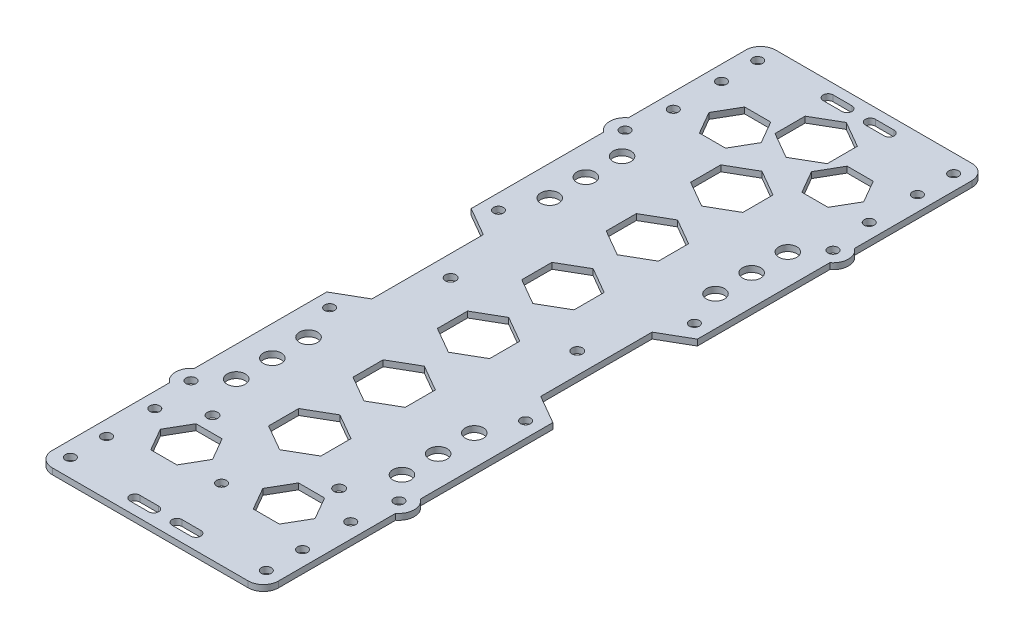
from build123d import *

# Parameters (mm, degrees)
SKETCH1_R           = 3
SKETCH1_R_2         = 1.65
BOSS_EXTRUDE1_DEPTH = 2
BOSS_EXTRUDE2_START = -2
SKETCH2_R           = 5.090936199
SKETCH2_R_2         = 1.65
BOSS_EXTRUDE2_DEPTH = 2
SKETCH3_R           = 1.65
CUT_EXTRUDE1_DEPTH  = 10
SKETCH4_R           = 1.75
CUT_EXTRUDE2_DEPTH  = 10


with BuildPart() as part:
    # Sketch1 → Boss-Extrude1 (new body)
    with BuildSketch(Plane(origin=(0, 0, 0), x_dir=(1, 0, 0), z_dir=(0, 1, 0))):
        with BuildLine():
            Line((37.525062814, 115), (37.525062814, 23.974506194))
            Line((37.525062814, 23.974506194), (28, 18.475208614))
            Line((28, 18.475208614), (28, -18.475208614))
            Line((28, -18.475208614), (37.525062814, -23.974506194))
            Line((37.525062814, -23.974506194), (37.525062814, -115))
            ThreePointArc((37.525062814, -115), (36.05174681, -118.544424535), (32.5, -120))
            Line((32.5, -120), (-32.5, -120))
            ThreePointArc((-32.5, -120), (-36.224769498, -118.363426816), (-37.5, -114.5))
            Line((-37.5, -114.5), (-37.5, -23.960036171))
            Line((-37.5, -23.960036171), (-28, -18.475208614))
            Line((-28, -18.475208614), (-28, 18.475208614))
            Line((-28, 18.475208614), (-37.5, 23.960036171))
            Line((-37.5, 23.960036171), (-37.5, 115.5))
            ThreePointArc((-37.5, 115.5), (-35.879164781, 118.708099244), (-32.525062814, 120))
            Line((-32.525062814, 120), (32.525062814, 120))
            ThreePointArc((32.525062814, 120), (36.06059672, 118.535533906), (37.525062814, 115))
        make_face()
        with Locations(Location((-27.497748671, 63.999999894, 0), (0, 0, 270))):
            Circle(SKETCH1_R, mode=Mode.SUBTRACT)
        with Locations(Location((-27.498874335, 51.999999947, 0), (0, 0, 270))):
            Circle(SKETCH1_R, mode=Mode.SUBTRACT)
        with Locations(Location((-27.5, 40, 0), (0, 0, 270))):
            Circle(SKETCH1_R, mode=Mode.SUBTRACT)
        with Locations(Location((27.5, 40, 0), (0, 0, 90))):
            Circle(SKETCH1_R, mode=Mode.SUBTRACT)
        with Locations(Location((27.498874335, 51.999999947, 0), (0, 0, 90))):
            Circle(SKETCH1_R, mode=Mode.SUBTRACT)
        with Locations(Location((27.497748671, 63.999999894, 0), (0, 0, 90))):
            Circle(SKETCH1_R, mode=Mode.SUBTRACT)
        with Locations(Location((27.497748671, -63.999999894, 0), (0, 0, 270))):
            Circle(SKETCH1_R, mode=Mode.SUBTRACT)
        with Locations(Location((27.498874335, -51.999999947, 0), (0, 0, 270))):
            Circle(SKETCH1_R, mode=Mode.SUBTRACT)
        with Locations(Location((27.5, -40, 0), (0, 0, 270))):
            Circle(SKETCH1_R, mode=Mode.SUBTRACT)
        with Locations(Location((-27.5, -40, 0), (0, 0, 90))):
            Circle(SKETCH1_R, mode=Mode.SUBTRACT)
        with Locations(Location((-27.498874335, -51.999999947, 0), (0, 0, 90))):
            Circle(SKETCH1_R, mode=Mode.SUBTRACT)
        with Locations(Location((-27.497748671, -63.999999894, 0), (0, 0, 90))):
            Circle(SKETCH1_R, mode=Mode.SUBTRACT)
        with Locations(Location((-34.497748671, 71.999999894, 0), (0, 0, 270))):
            Circle(SKETCH1_R_2, mode=Mode.SUBTRACT)
        with Locations(Location((34.497748671, 71.999999894, 0), (0, 0, 90))):
            Circle(SKETCH1_R_2, mode=Mode.SUBTRACT)
        with Locations(Location((34.497748671, -71.999999894, 0), (0, 0, 270))):
            Circle(SKETCH1_R_2, mode=Mode.SUBTRACT)
        with Locations(Location((-34.497748671, -71.999999894, 0), (0, 0, 90))):
            Circle(SKETCH1_R_2, mode=Mode.SUBTRACT)
    extrude(amount=BOSS_EXTRUDE1_DEPTH)

    # Sketch2 → Boss-Extrude2 (add)
    # profile 1 of 4: a face of its own
    with BuildSketch(Plane(origin=(0, 2, 0), x_dir=(1, 0, 0), z_dir=(0, 1, 0)).offset(BOSS_EXTRUDE2_START)):
        with Locations((-34.497748671, 71.999999894)):
            Circle(SKETCH2_R)
        with Locations(Location((-34.497748671, 71.999999894, 0), (0, 0, 270))):
            Circle(SKETCH2_R_2, mode=Mode.SUBTRACT)
    # profile 2 of 4: a face of its own
    with BuildSketch(Plane(origin=(0, 2, 0), x_dir=(1, 0, 0), z_dir=(0, 1, 0)).offset(BOSS_EXTRUDE2_START)):
        with Locations((34.497748671, 71.999999894)):
            Circle(SKETCH2_R)
        with Locations(Location((34.497748671, 71.999999894, 0), (0, 0, 90))):
            Circle(SKETCH2_R_2, mode=Mode.SUBTRACT)
    # profile 3 of 4: a face of its own
    with BuildSketch(Plane(origin=(0, 2, 0), x_dir=(1, 0, 0), z_dir=(0, 1, 0)).offset(BOSS_EXTRUDE2_START)):
        with Locations((34.497748671, -71.999999894)):
            Circle(SKETCH2_R)
        with Locations(Location((34.497748671, -71.999999894, 0), (0, 0, 270))):
            Circle(SKETCH2_R_2, mode=Mode.SUBTRACT)
    # profile 4 of 4: a face of its own
    with BuildSketch(Plane(origin=(0, 2, 0), x_dir=(1, 0, 0), z_dir=(0, 1, 0)).offset(BOSS_EXTRUDE2_START)):
        with Locations((-34.497748671, -71.999999894)):
            Circle(SKETCH2_R)
        with Locations(Location((-34.497748671, -71.999999894, 0), (0, 0, 90))):
            Circle(SKETCH2_R_2, mode=Mode.SUBTRACT)
    extrude(amount=BOSS_EXTRUDE2_DEPTH)

    # Sketch3 → Cut-Extrude1 (cut)
    with BuildSketch(Plane(origin=(0, 2, 0), x_dir=(1, 0, 0), z_dir=(0, 1, 0))):
        with Locations(Location((-32.5, 114, 0), (0, 0, 270))):
            Circle(SKETCH3_R)
        with Locations(Location((-32.5, 102, 0), (0, 0, 270))):
            Circle(SKETCH3_R)
        with Locations(Location((-32.5, 86, 0), (0, 0, 270))):
            Circle(SKETCH3_R)
        with Locations(Location((-32.5, 28, 0), (0, 0, 270))):
            Circle(SKETCH3_R)
        with Locations(Location((32.5, 28, 0), (0, 0, 90))):
            Circle(SKETCH3_R)
        with Locations(Location((32.5, 86, 0), (0, 0, 90))):
            Circle(SKETCH3_R)
        with Locations(Location((32.5, 102, 0), (0, 0, 90))):
            Circle(SKETCH3_R)
        with Locations(Location((32.5, 114, 0), (0, 0, 90))):
            Circle(SKETCH3_R)
        with Locations(Location((32.5, -114, 0), (0, 0, 270))):
            Circle(SKETCH3_R)
        with Locations(Location((32.5, -102, 0), (0, 0, 270))):
            Circle(SKETCH3_R)
        with Locations(Location((32.5, -86, 0), (0, 0, 270))):
            Circle(SKETCH3_R)
        with Locations(Location((32.5, -28, 0), (0, 0, 270))):
            Circle(SKETCH3_R)
        with Locations(Location((0, -96.35, 0), (0, 0, 270))):
            Circle(SKETCH3_R)
        with Locations(Location((-32.5, -28, 0), (0, 0, 90))):
            Circle(SKETCH3_R)
        with Locations(Location((-32.5, -86, 0), (0, 0, 90))):
            Circle(SKETCH3_R)
        with Locations(Location((-32.5, -102, 0), (0, 0, 90))):
            Circle(SKETCH3_R)
        with Locations(Location((-32.5, -114, 0), (0, 0, 90))):
            Circle(SKETCH3_R)
        Polygon((0, 82.909485966), (-8.660254038, 77.909485966), (-8.660254038, 67.909485966), (0, 62.909485966), (8.660254038, 67.909485966), (8.660254038, 77.909485966), align=None)
        Polygon((0, 110.909485966), (-8.660254038, 105.909485966), (-8.660254038, 95.909485966), (0, 90.909485966), (8.660254038, 95.909485966), (8.660254038, 105.909485966), align=None)
        Polygon((0, 54.909485966), (-8.660254038, 49.909485966), (-8.660254038, 39.909485966), (0, 34.909485966), (8.660254038, 39.909485966), (8.660254038, 49.909485966), align=None)
        Polygon((0, 26.909485966), (-8.660254038, 21.909485966), (-8.660254038, 11.909485966), (0, 6.909485966), (8.660254038, 11.909485966), (8.660254038, 21.909485966), align=None)
        Polygon((0, -1.090514034), (-8.660254038, -6.090514034), (-8.660254038, -16.090514034), (0, -21.090514034), (8.660254038, -16.090514034), (8.660254038, -6.090514034), align=None)
        Polygon((0, -29.090514034), (-8.660254038, -34.090514034), (-8.660254038, -44.090514034), (0, -49.090514034), (8.660254038, -44.090514034), (8.660254038, -34.090514034), align=None)
        Polygon((0, -57.090514034), (-8.660254038, -62.090514034), (-8.660254038, -72.090514034), (0, -77.090514034), (8.660254038, -72.090514034), (8.660254038, -62.090514034), align=None)
        with BuildLine():
            Line((-10.125189832, 116.65), (-3.874810168, 116.65))
            ThreePointArc((-3.874810168, 116.65), (-2.224810168, 115), (-3.874810168, 113.35))
            Line((-3.874810168, 113.35), (-10.125189832, 113.35))
            ThreePointArc((-10.125189832, 113.35), (-11.775189832, 115), (-10.125189832, 116.65))
        make_face()
        with BuildLine():
            Line((10.125189832, 116.65), (3.874810168, 116.65))
            ThreePointArc((3.874810168, 116.65), (2.224810168, 115), (3.874810168, 113.35))
            Line((3.874810168, 113.35), (10.125189832, 113.35))
            ThreePointArc((10.125189832, 113.35), (11.775189832, 115), (10.125189832, 116.65))
        make_face()
        with BuildLine():
            Line((10.125189832, -116.65), (3.874810168, -116.65))
            ThreePointArc((3.874810168, -116.65), (2.224810168, -115), (3.874810168, -113.35))
            Line((3.874810168, -113.35), (10.125189832, -113.35))
            ThreePointArc((10.125189832, -113.35), (11.775189832, -115), (10.125189832, -116.65))
        make_face()
        with BuildLine():
            Line((-10.125189832, -116.65), (-3.874810168, -116.65))
            ThreePointArc((-3.874810168, -116.65), (-2.224810168, -115), (-3.874810168, -113.35))
            Line((-3.874810168, -113.35), (-10.125189832, -113.35))
            ThreePointArc((-10.125189832, -113.35), (-11.775189832, -115), (-10.125189832, -116.65))
        make_face()
        Polygon((12.669872981, 83.5), (8.339745962, 91), (12.669872981, 98.5), (21.330127019, 98.5), (25.660254038, 91), (21.330127019, 83.5), align=None)
        Polygon((-8.339745962, 91), (-12.669872981, 98.5), (-21.330127019, 98.5), (-25.660254038, 91), (-21.330127019, 83.5), (-12.669872981, 83.5), align=None)
        Polygon((21.330127019, -83.5), (12.669872981, -83.5), (8.339745962, -91), (12.669872981, -98.5), (21.330127019, -98.5), (25.660254038, -91), align=None)
        Polygon((-12.669872981, -83.5), (-8.339745962, -91), (-12.669872981, -98.5), (-21.330127019, -98.5), (-25.660254038, -91), (-21.330127019, -83.5), align=None)
    extrude(amount=-CUT_EXTRUDE1_DEPTH, mode=Mode.SUBTRACT)

    # Sketch4 → Cut-Extrude2 (cut)
    with BuildSketch(Plane(origin=(0, 2, 0), x_dir=(1, 0, 0), z_dir=(0, 1, 0))):
        with Locations(Location((-21, -78.35, 0), (0, 0, 270))):
            Circle(SKETCH4_R)
        with Locations(Location((21, -78.35, 0), (0, 0, 270))):
            Circle(SKETCH4_R)
        with Locations(Location((-21, 0.65, 0), (0, 0, 270))):
            Circle(SKETCH4_R)
        with Locations(Location((21, 0.65, 0), (0, 0, 270))):
            Circle(SKETCH4_R)
    extrude(amount=-CUT_EXTRUDE2_DEPTH, mode=Mode.SUBTRACT)


solid = part.part
